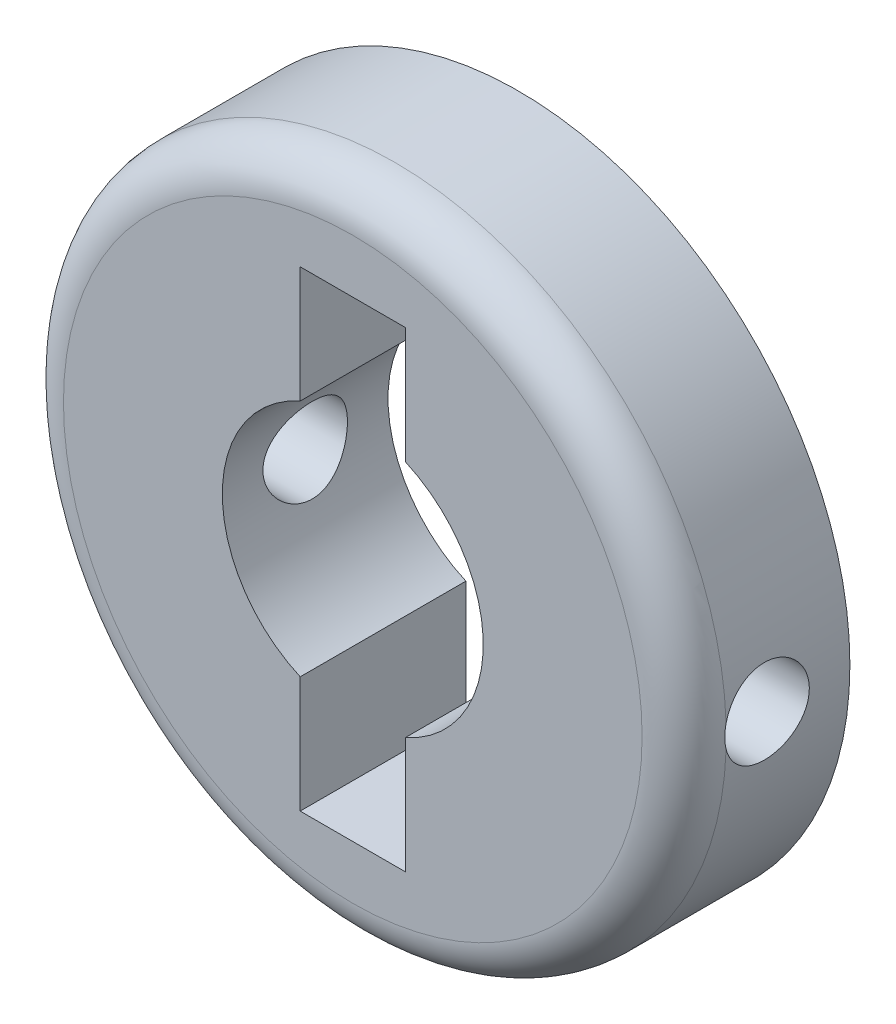
from build123d import *

# Parameters (mm, degrees)
SKETCH1_R               = 10
BOSS_EXTRUDE1_DEPTH     = 2.5
CUT_EXTRUDE1_DEPTH      = 15.361406616
CUT_EXTRUDE1_DEPTH_BACK = 15.361406616
SKETCH4_R               = 1.275
FILLET1_R               = 1.27


with BuildPart() as part:
    # Sketch1 → Boss-Extrude1 (new, symmetric)
    with BuildSketch(Plane.XY):
        Circle(SKETCH1_R)
        with BuildLine():
            Line((1.5875, 3.60275072), (1.5875, 7.112))
            Line((1.5875, 7.112), (-1.5875, 7.112))
            Line((-1.5875, 7.112), (-1.5875, 3.60275072))
            ThreePointArc((-1.5875, 3.60275072), (-3.937, 0), (-1.5875, -3.60275072))
            Line((-1.5875, -3.60275072), (-1.5875, -7.112))
            Line((-1.5875, -7.112), (1.5875, -7.112))
            Line((1.5875, -7.112), (1.5875, -3.60275072))
            ThreePointArc((1.5875, -3.60275072), (3.937, 0), (1.5875, 3.60275072))
        make_face(mode=Mode.SUBTRACT)
    extrude(amount=BOSS_EXTRUDE1_DEPTH, both=True)

    # Sketch4 → Cut-Extrude1 (cut, two sides: drawn at the far end of the back side and taken through both)
    with BuildSketch(Plane(origin=(0, 0, 0), x_dir=(0, 0, -1), z_dir=(1, 0, 0)).offset(-CUT_EXTRUDE1_DEPTH_BACK)):
        Circle(SKETCH4_R)
    extrude(amount=CUT_EXTRUDE1_DEPTH + CUT_EXTRUDE1_DEPTH_BACK, mode=Mode.SUBTRACT)

    # Fillet1
    fillet1_edges = [part.edges().sort_by_distance(p)[0] for p in [
        (-10, 0, 2.5),
    ]]
    fillet(fillet1_edges, radius=FILLET1_R)


solid = part.part
